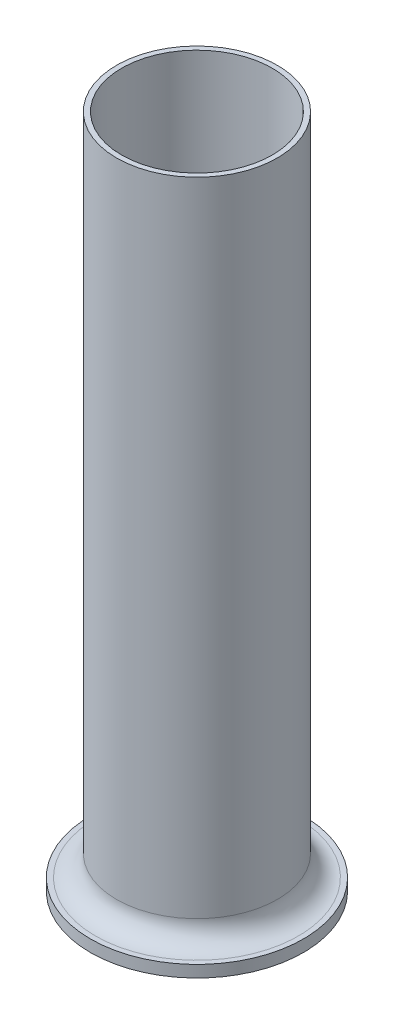
from build123d import *

# Parameters (mm, degrees)
SKETCH_1_R          = 25.25
EXTRUDE_1_DEPTH     = 2.8
SKETCH_2_R          = 19.05
EXTRUDE_2_DEPTH     = 157.2
FILLET_1_R          = 5
SKETCH_3_R          = 17.85
CUT_EXTRUDE_1_DEPTH = 164.936344354
SKETCH_5_R          = 1.8


with BuildPart() as part:
    # 스케치1 → 보스-돌출1 (new body)
    with BuildSketch(Plane(origin=(0, 0, 0), x_dir=(1, 0, 0), z_dir=(0, 1, 0))):
        with Locations(Location((0, 0, 0), (0, 0, 270))):
            Circle(SKETCH_1_R)
    extrude(amount=EXTRUDE_1_DEPTH)

    # 스케치2 → 보스-돌출2 (add)
    with BuildSketch(Plane(origin=(0, 2.8, 0), x_dir=(1, 0, 0), z_dir=(0, 1, 0))):
        with Locations(Location((0, 0, 0), (0, 0, 270))):
            Circle(SKETCH_2_R)
    extrude(amount=EXTRUDE_2_DEPTH)

    # 필렛1
    fillet_1_edges = [part.edges().sort_by_distance(p)[0] for p in [
        (0, 2.8, -19.05),
    ]]
    fillet(fillet_1_edges, radius=FILLET_1_R)

    # 스케치3 → 컷-돌출1 (cut, through all)
    with BuildSketch(Plane(origin=(0, 160, 0), x_dir=(1, 0, 0), z_dir=(0, 1, 0))):
        with Locations(Location((0, 0, 0), (0, 0, 270))):
            Circle(SKETCH_3_R)
    extrude(amount=-CUT_EXTRUDE_1_DEPTH, mode=Mode.SUBTRACT)

    # 컷-스윕1: sweep along a path in 스케치4
    with BuildLine(Plane.XZ) as sweep_1_path:
        CenterArc((0, 0), 21.75, 0, 360)
    # 스케치5 → 컷-스윕1 (sweep, cut)
    with BuildSketch(Plane.XY):
        with Locations((-21.75, 0)):
            Circle(SKETCH_5_R)
    sweep(path=sweep_1_path.line, mode=Mode.SUBTRACT)


solid = part.part
